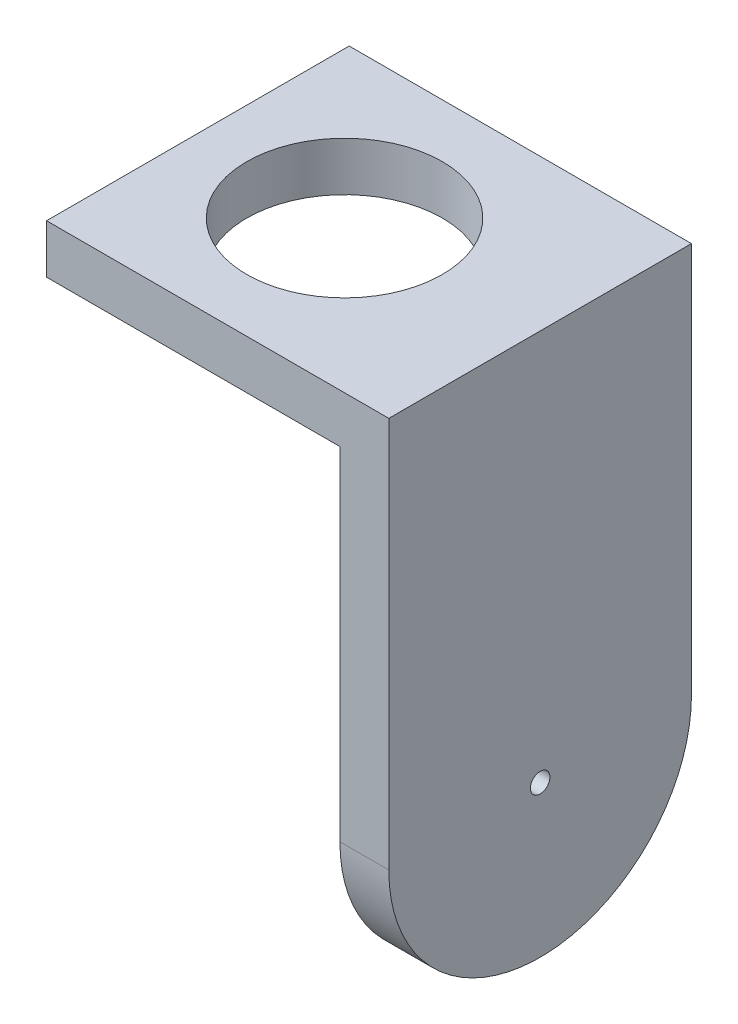
from build123d import *

# Parameters (mm, degrees)
BOSS_EXTRUDE2_DEPTH = 5
SKETCH5_R           = 1
CUT_EXTRUDE2_DEPTH  = 5
SKETCH6_W           = 30.946174702
SKETCH6_H           = 5
BOSS_EXTRUDE3_DEPTH = 30
SKETCH10_R          = 10
CUT_EXTRUDE3_DEPTH  = 30


with BuildPart() as part:
    # Sketch3 → Boss-Extrude2 (new body)
    with BuildSketch(Plane(origin=(0, 0, 0), x_dir=(0, 0, -1), z_dir=(1, 0, 0))):
        with BuildLine():
            Line((15.473087351, -60.931791337), (-15.473087351, -60.931791337))
            Line((-15.473087351, -60.931791337), (-15.473087351, -100.931791337))
            ThreePointArc((-15.473087351, -100.931791337), (0, -116.404878688), (15.473087351, -100.931791337))
            Line((15.473087351, -100.931791337), (15.473087351, -60.931791337))
        make_face()
    extrude(amount=BOSS_EXTRUDE2_DEPTH)

    # Sketch5 → Cut-Extrude2 (cut)
    with BuildSketch(Plane.ZY):
        with Locations((0, -100.931791337)):
            Circle(SKETCH5_R)
    extrude(amount=-CUT_EXTRUDE2_DEPTH, mode=Mode.SUBTRACT)

    # Sketch6 → Boss-Extrude3 (add)
    with BuildSketch(Plane.ZY):
        with Locations((0, -63.431791337)):
            Rectangle(SKETCH6_W, SKETCH6_H)
    extrude(amount=BOSS_EXTRUDE3_DEPTH)

    # Sketch10 → Cut-Extrude3 (cut)
    with BuildSketch(Plane.XZ.offset(65.931791337)):
        with Locations(Location((-15, 0, 0), (0, 0, 270))):
            Circle(SKETCH10_R)
    extrude(amount=-CUT_EXTRUDE3_DEPTH, mode=Mode.SUBTRACT)


solid = part.part
